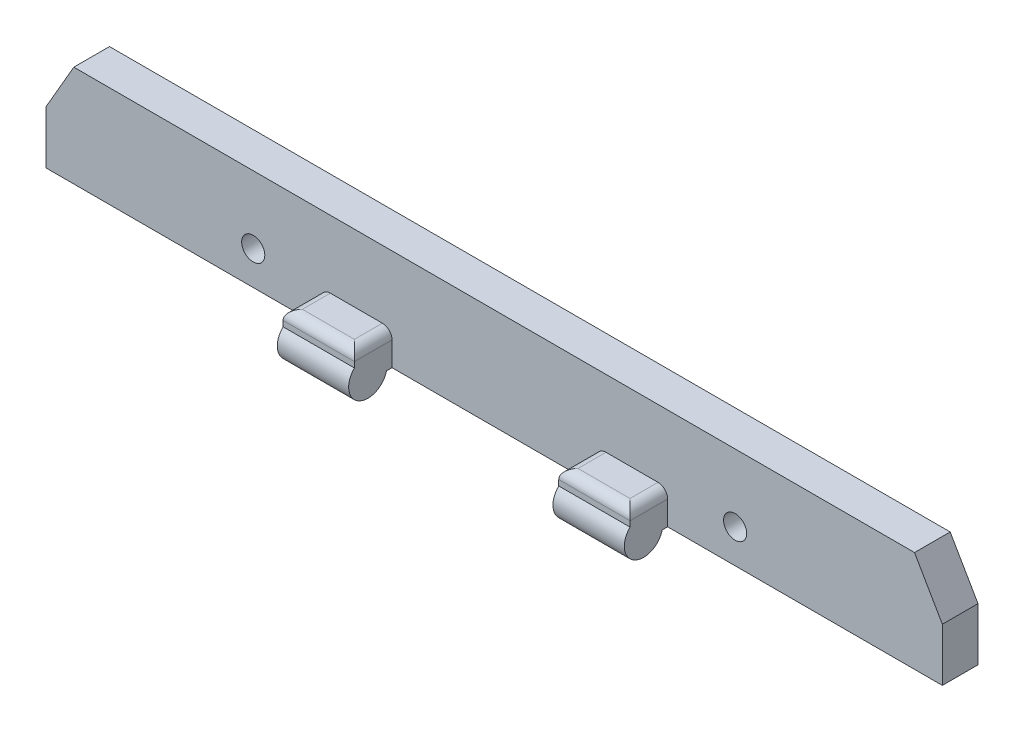
from build123d import *

# Parameters (mm, degrees)
SKETCH_1_W          = 93
SKETCH_1_H          = 7
SKETCH_1_R          = 1.2
EXTRUDE_1_DEPTH     = 3.7
SKETCH_2_W          = 7.4
SKETCH_2_H          = 3.5
EXTRUDE_2_DEPTH     = 5
EXTRUDE_3_DEPTH     = 7.4
EXTRUDE_START       = -7.4
EXTRUDE_4_DEPTH     = 7.4
CUT_EXTRUDE_1_DEPTH = 48.03456176
EXTRUDE_5_DEPTH     = 3.7
CUT_EXTRUDE_2_DEPTH = 66.459453099
FILLET_1_R          = 1


with BuildPart() as part:
    # ｽｹｯﾁ1 → ﾎﾞｽ - 押し出し1 (new body)
    with BuildSketch(Plane.XY):
        Rectangle(SKETCH_1_W, SKETCH_1_H)
        with Locations((-25, 0)):
            Circle(SKETCH_1_R, mode=Mode.SUBTRACT)
        with Locations((25, 0)):
            Circle(SKETCH_1_R, mode=Mode.SUBTRACT)
    extrude(amount=EXTRUDE_1_DEPTH)

    # ｽｹｯﾁ2 → ﾎﾞｽ - 押し出し2 (add)
    with BuildSketch(Plane.XY.offset(3.7)):
        with Locations((-14.3, -1.75)):
            Rectangle(SKETCH_2_W, SKETCH_2_H)
        with Locations((14.3, -1.75)):
            Rectangle(SKETCH_2_W, SKETCH_2_H)
    extrude(amount=EXTRUDE_2_DEPTH)

    # ｽｹｯﾁ3 → ﾎﾞｽ - 押し出し3 (add)
    with BuildSketch(Plane.ZY.offset(18)):
        with BuildLine():
            Line((4.263508327, -3.5), (8.136491673, -3.5))
            ThreePointArc((8.136491673, -3.5), (6.2, -5), (4.263508327, -3.5))
        make_face()
    extrude(amount=-EXTRUDE_3_DEPTH)

    # ｽｹｯﾁ4 → ﾎﾞｽ - 押し出し4 (add)
    with BuildSketch(Plane(origin=(18, 0, 0), x_dir=(0, 0, -1), z_dir=(1, 0, 0)).offset(EXTRUDE_START)):
        with BuildLine():
            Line((-8.136491673, -3.5), (-4.263508327, -3.5))
            ThreePointArc((-4.263508327, -3.5), (-6.2, -5), (-8.136491673, -3.5))
        make_face()
    extrude(amount=EXTRUDE_4_DEPTH)

    # ｽｹｯﾁ5 → ｶｯﾄ - 押し出し1 (cut, through all)
    with BuildSketch(Plane.XY.offset(3.7)):
        Polygon((-46.5, 2), (-45.633974596, 3.5), (-46.5, 3.5), align=None)
        Polygon((46.5, 3.5), (46.5, 2), (45.633974596, 3.5), align=None)
    extrude(amount=-CUT_EXTRUDE_1_DEPTH, mode=Mode.SUBTRACT)

    # ｽｹｯﾁ6 → ﾎﾞｽ - 押し出し5 (add)
    with BuildSketch(Plane.XY.offset(3.7)):
        Polygon((-45.633974596, 3.5), (45.633974596, 3.5), (43.613248654, 7), (-43.613248654, 7), align=None)
    extrude(amount=-EXTRUDE_5_DEPTH)

    # ｽｹｯﾁ7 → ｶｯﾄ - 押し出し2 (cut, through all)
    with BuildSketch(Plane(origin=(18, 0, 0), x_dir=(0, 0, -1), z_dir=(1, 0, 0))):
        with BuildLine():
            Line((-7.601258538, -1.572949017), (-7.601258538, 0))
            Line((-7.601258538, 0), (-8.7, 0))
            Line((-8.7, 0), (-8.7, -3.5))
            Line((-8.7, -3.5), (-8.136491673, -3.5))
            ThreePointArc((-8.136491673, -3.5), (-8.127050983, -2.464766865), (-7.601258538, -1.572949017))
        make_face()
    extrude(amount=-CUT_EXTRUDE_2_DEPTH, mode=Mode.SUBTRACT)

    # ﾌｨﾚｯﾄ1
    fillet_1_edges = [part.edges().sort_by_distance(p)[0] for p in [
        (10.6, 0, 5.650629269),
        (18, 0, 5.650629269),
        (-18, 0, 5.650629269),
        (-10.6, 0, 5.650629269),
        (-14.3, 0, 7.601258538),
        (14.3, 0, 7.601258538),
    ]]
    fillet(fillet_1_edges, radius=FILLET_1_R)


solid = part.part
